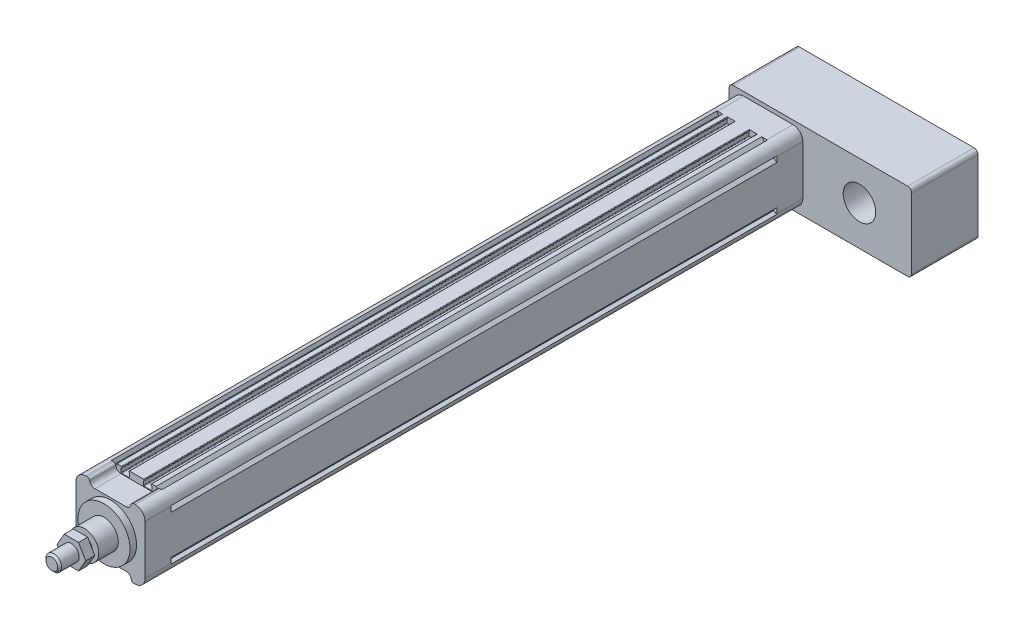
from build123d import *

# Parameters (mm, degrees)
SKETCH_1_R                  = 2.1
EXTRUDE_1_DEPTH             = 465
EXTRUDE_2_DEPTH             = 20
SKETCH_7_R                  = 20
EXTRUDE_3_DEPTH             = 5
SKETCH_9_R                  = 11
EXTRUDE_4_DEPTH             = 15
SKETCH_10_R                 = 6
EXTRUDE_5_DEPTH             = 25
EXTRUDE_START               = 20
EXTRUDE_6_DEPTH             = 20
EXTRUDE_7_DEPTH             = 51
SKETCH_13_R                 = 12.5
CUT_EXTRUDE_2_DEPTH         = 30
PATTERN_LINEAR_1_COUNT      = 2
PATTERN_LINEAR_1_PITCH      = 38
PATTERN_LINEAR_1_COUNT_DIR2 = 2
PATTERN_LINEAR_1_PITCH_DIR2 = 38
HOLE_WIZARD_M6_2_D          = 5
HOLE_WIZARD_M6_2_DEPTH      = 15
HOLE_WIZARD_M6_2_TIP        = 1.502151548
HOLE_WIZARD_M6_3_D          = 5
HOLE_WIZARD_M6_3_DEPTH      = 15
HOLE_WIZARD_M6_3_TIP        = 1.502151548
HOLE_WIZARD_M6_4_D          = 5
HOLE_WIZARD_M6_4_DEPTH      = 15
HOLE_WIZARD_M6_4_TIP        = 1.502151548
CHAMFER_1_SIZE              = 1.5
EXTRUDE_START_2             = 3
EXTRUDE_8_DEPTH             = 7


with BuildPart() as part:
    # 草图1 → 凸台-拉伸1 (new body)
    with BuildSketch(Plane.XY):
        with BuildLine():
            Line((-18.2, 24), (-19.443439638, 26.486879276))
            ThreePointArc((-19.443439638, 26.486879276), (-24.303300859, 24.303300859), (-26.486879276, 19.443439638))
            Line((-26.486879276, 19.443439638), (-24, 18.2))
            Line((-24, 18.2), (-24, 17.1))
            Line((-24, 17.1), (-26.5, 15))
            Line((-26.5, 15), (-26.5, -15))
            Line((-26.5, -15), (-24, -17.1))
            Line((-24, -17.1), (-24, -18.2))
            Line((-24, -18.2), (-26.486879276, -19.443439638))
            ThreePointArc((-26.486879276, -19.443439638), (-24.303300859, -24.303300859), (-19.443439638, -26.486879276))
            Line((-19.443439638, -26.486879276), (-18.2, -24))
            Line((-18.2, -24), (-17.1, -24))
            Line((-17.1, -24), (-15, -26.5))
            Line((-15, -26.5), (-11.65, -26.5))
            ThreePointArc((-11.65, -26.5), (-11.367157288, -26.382842712), (-11.25, -26.1))
            Line((-11.25, -26.1), (-11.25, -25.6))
            ThreePointArc((-11.25, -25.6), (-11.367157288, -25.317157288), (-11.65, -25.2))
            Line((-11.65, -25.2), (-11.75, -25.2))
            Line((-11.75, -25.2), (-11.75, -22.4))
            ThreePointArc((-11.75, -22.4), (-11.632842712, -22.117157288), (-11.35, -22))
            Line((-11.35, -22), (-5.65, -22))
            ThreePointArc((-5.65, -22), (-5.367157288, -22.117157288), (-5.25, -22.4))
            Line((-5.25, -22.4), (-5.25, -25.2))
            Line((-5.25, -25.2), (-5.35, -25.2))
            ThreePointArc((-5.35, -25.2), (-5.632842712, -25.317157288), (-5.75, -25.6))
            Line((-5.75, -25.6), (-5.75, -26.1))
            ThreePointArc((-5.75, -26.1), (-5.632842712, -26.382842712), (-5.35, -26.5))
            Line((-5.35, -26.5), (5.35, -26.5))
            ThreePointArc((5.35, -26.5), (5.632842712, -26.382842712), (5.75, -26.1))
            Line((5.75, -26.1), (5.75, -25.6))
            ThreePointArc((5.75, -25.6), (5.632842712, -25.317157288), (5.35, -25.2))
            Line((5.35, -25.2), (5.25, -25.2))
            Line((5.25, -25.2), (5.25, -22.4))
            ThreePointArc((5.25, -22.4), (5.367157288, -22.117157288), (5.65, -22))
            Line((5.65, -22), (11.35, -22))
            ThreePointArc((11.35, -22), (11.632842712, -22.117157288), (11.75, -22.4))
            Line((11.75, -22.4), (11.75, -25.2))
            Line((11.75, -25.2), (11.65, -25.2))
            ThreePointArc((11.65, -25.2), (11.367157288, -25.317157288), (11.25, -25.6))
            Line((11.25, -25.6), (11.25, -26.1))
            ThreePointArc((11.25, -26.1), (11.367157288, -26.382842712), (11.65, -26.5))
            Line((11.65, -26.5), (15, -26.5))
            Line((15, -26.5), (17.1, -24))
            Line((17.1, -24), (18.2, -24))
            Line((18.2, -24), (19.443439638, -26.486879276))
            ThreePointArc((19.443439638, -26.486879276), (24.303300859, -24.303300859), (26.486879276, -19.443439638))
            Line((26.486879276, -19.443439638), (24, -18.2))
            Line((24, -18.2), (24, -17.1))
            Line((24, -17.1), (26.5, -15))
            Line((26.5, -15), (26.5, 15))
            Line((26.5, 15), (24, 17.1))
            Line((24, 17.1), (24, 18.2))
            Line((24, 18.2), (26.486879276, 19.443439638))
            ThreePointArc((26.486879276, 19.443439638), (24.303300859, 24.303300859), (19.443439638, 26.486879276))
            Line((19.443439638, 26.486879276), (18.2, 24))
            Line((18.2, 24), (17.1, 24))
            Line((17.1, 24), (15, 26.5))
            Line((15, 26.5), (11.65, 26.5))
            ThreePointArc((11.65, 26.5), (11.367157288, 26.382842712), (11.25, 26.1))
            Line((11.25, 26.1), (11.25, 25.6))
            ThreePointArc((11.25, 25.6), (11.367157288, 25.317157288), (11.65, 25.2))
            Line((11.65, 25.2), (11.75, 25.2))
            Line((11.75, 25.2), (11.75, 22.4))
            ThreePointArc((11.75, 22.4), (11.632842712, 22.117157288), (11.35, 22))
            Line((11.35, 22), (5.65, 22))
            ThreePointArc((5.65, 22), (5.367157288, 22.117157288), (5.25, 22.4))
            Line((5.25, 22.4), (5.25, 25.2))
            Line((5.25, 25.2), (5.35, 25.2))
            ThreePointArc((5.35, 25.2), (5.632842712, 25.317157288), (5.75, 25.6))
            Line((5.75, 25.6), (5.75, 26.1))
            ThreePointArc((5.75, 26.1), (5.632842712, 26.382842712), (5.35, 26.5))
            Line((5.35, 26.5), (-5.35, 26.5))
            ThreePointArc((-5.35, 26.5), (-5.632842712, 26.382842712), (-5.75, 26.1))
            Line((-5.75, 26.1), (-5.75, 25.6))
            ThreePointArc((-5.75, 25.6), (-5.632842712, 25.317157288), (-5.35, 25.2))
            Line((-5.35, 25.2), (-5.25, 25.2))
            Line((-5.25, 25.2), (-5.25, 22.4))
            ThreePointArc((-5.25, 22.4), (-5.367157288, 22.117157288), (-5.65, 22))
            Line((-5.65, 22), (-11.35, 22))
            ThreePointArc((-11.35, 22), (-11.632842712, 22.117157288), (-11.75, 22.4))
            Line((-11.75, 22.4), (-11.75, 25.2))
            Line((-11.75, 25.2), (-11.65, 25.2))
            ThreePointArc((-11.65, 25.2), (-11.367157288, 25.317157288), (-11.25, 25.6))
            Line((-11.25, 25.6), (-11.25, 26.1))
            ThreePointArc((-11.25, 26.1), (-11.367157288, 26.382842712), (-11.65, 26.5))
            Line((-11.65, 26.5), (-15, 26.5))
            Line((-15, 26.5), (-17.1, 24))
            Line((-17.1, 24), (-18.2, 24))
        make_face()
        with Locations((19, 19)):
            Circle(SKETCH_1_R, mode=Mode.SUBTRACT)
        with Locations((19, -19)):
            Circle(SKETCH_1_R, mode=Mode.SUBTRACT)
        with Locations((-19, -19)):
            Circle(SKETCH_1_R, mode=Mode.SUBTRACT)
        with Locations((-19, 19)):
            Circle(SKETCH_1_R, mode=Mode.SUBTRACT)
        with BuildLine():
            Line((19.773719933, 3), (23.3, 3))
            Line((23.3, 3), (23.3, -3))
            Line((23.3, -3), (19.773719933, -3))
            ThreePointArc((19.773719933, -3), (0, -20), (-19.773719933, -3))
            Line((-19.773719933, -3), (-23.3, -3))
            Line((-23.3, -3), (-23.3, 3))
            Line((-23.3, 3), (-19.773719933, 3))
            ThreePointArc((-19.773719933, 3), (0, 20), (19.773719933, 3))
        make_face(mode=Mode.SUBTRACT)
    extrude(amount=EXTRUDE_1_DEPTH)

    # 草图6 → 凸台-拉伸2 (add)
    with BuildSketch(Plane.XY.offset(465)):
        with BuildLine():
            Line((-26.5, -19), (-26.5, 19))
            ThreePointArc((-26.5, 19), (-24.303300859, 24.303300859), (-19, 26.5))
            Line((-19, 26.5), (-17.916079783, 26.5))
            ThreePointArc((-17.916079783, 26.5), (-16.625085334, 26.027525232), (-15.944053189, 24.833333333))
            ThreePointArc((-15.944053189, 24.833333333), (-14.581988897, 22.444949537), (-12, 21.5))
            Line((-12, 21.5), (12, 21.5))
            ThreePointArc((12, 21.5), (14.581988897, 22.444949537), (15.944053189, 24.833333333))
            ThreePointArc((15.944053189, 24.833333333), (16.625085334, 26.027525232), (17.916079783, 26.5))
            Line((17.916079783, 26.5), (19, 26.5))
            ThreePointArc((19, 26.5), (24.303300859, 24.303300859), (26.5, 19))
            Line((26.5, 19), (26.5, -19))
            ThreePointArc((26.5, -19), (24.303300859, -24.303300859), (19, -26.5))
            Line((19, -26.5), (17.916079783, -26.5))
            ThreePointArc((17.916079783, -26.5), (16.625085334, -26.027525232), (15.944053189, -24.833333333))
            ThreePointArc((15.944053189, -24.833333333), (14.581988897, -22.444949537), (12, -21.5))
            Line((12, -21.5), (-12, -21.5))
            ThreePointArc((-12, -21.5), (-14.581988897, -22.444949537), (-15.944053189, -24.833333333))
            ThreePointArc((-15.944053189, -24.833333333), (-16.625085334, -26.027525232), (-17.916079783, -26.5))
            Line((-17.916079783, -26.5), (-19, -26.5))
            ThreePointArc((-19, -26.5), (-24.303300859, -24.303300859), (-26.5, -19))
        make_face()
    extrude(amount=EXTRUDE_2_DEPTH)

    # 草图7 → 凸台-拉伸3 (add)
    with BuildSketch(Plane.XY.offset(485)):
        Circle(SKETCH_7_R)
    extrude(amount=EXTRUDE_3_DEPTH)

    # 草图9 → 凸台-拉伸4 (add)
    with BuildSketch(Plane.XY.offset(490)):
        Circle(SKETCH_9_R)
    extrude(amount=EXTRUDE_4_DEPTH)

    # 草图10 → 凸台-拉伸5 (add)
    with BuildSketch(Plane.XY.offset(505)):
        Circle(SKETCH_10_R)
    extrude(amount=EXTRUDE_5_DEPTH)

    # 草图11 → 凸台-拉伸6 (add)
    with BuildSketch(Plane(origin=(0, 0, 0), x_dir=(-1, 0, 0), z_dir=(0, 0, -1)).offset(EXTRUDE_START)):
        with BuildLine():
            Line((-19, -26.5), (19, -26.5))
            ThreePointArc((19, -26.5), (24.303300859, -24.303300859), (26.5, -19))
            Line((26.5, -19), (26.5, 19))
            ThreePointArc((26.5, 19), (24.303300859, 24.303300859), (19, 26.5))
            Line((19, 26.5), (-19, 26.5))
            ThreePointArc((-19, 26.5), (-24.303300859, 24.303300859), (-26.5, 19))
            Line((-26.5, 19), (-26.5, -19))
            ThreePointArc((-26.5, -19), (-24.303300859, -24.303300859), (-19, -26.5))
        make_face()
    extrude(amount=-EXTRUDE_6_DEPTH)

    # 草图12 → 凸台-拉伸7 (add)
    with BuildSketch(Plane(origin=(0, 0, -20), x_dir=(-1, 0, 0), z_dir=(0, 0, -1))):
        with BuildLine():
            Line((-107, -30.404162038), (27, -30.404162038))
            ThreePointArc((27, -30.404162038), (29.121320344, -29.525482382), (30, -27.404162038))
            Line((30, -27.404162038), (30, 26.595837962))
            ThreePointArc((30, 26.595837962), (29.121320344, 28.717158305), (27, 29.595837962))
            Line((27, 29.595837962), (-107, 29.595837962))
            ThreePointArc((-107, 29.595837962), (-109.121320344, 28.717158305), (-110, 26.595837962))
            Line((-110, 26.595837962), (-110, -27.404162038))
            ThreePointArc((-110, -27.404162038), (-109.121320344, -29.525482382), (-107, -30.404162038))
        make_face()
    extrude(amount=EXTRUDE_7_DEPTH)

    # 草图13 → 切除-拉伸2 (cut)
    with BuildSketch(Plane.XY.offset(-20)):
        with Locations((70, 0)):
            Circle(SKETCH_13_R)
    extrude(amount=-CUT_EXTRUDE_2_DEPTH, mode=Mode.SUBTRACT)

    # 草图15 → M6 螺纹孔1 (revolve, cut)
    with BuildSketch(Plane(origin=(-19, -19, -71), x_dir=(0, 1, 0), z_dir=(1, 0, 0))):
        Polygon((0, 0), (0, 16.502151548), (2.5, 15), (2.5, 0), align=None)
    hole_wizard_m6_1 = revolve(axis=Axis((-19, -19, -77.35), (0, 0, 1)), mode=Mode.SUBTRACT)

    # 阵列(线性)1: Hole Wizard M6 _1 2 × 2
    with Locations(*[(j * PATTERN_LINEAR_1_PITCH_DIR2, i * PATTERN_LINEAR_1_PITCH, 0) for i in range(PATTERN_LINEAR_1_COUNT) for j in range(PATTERN_LINEAR_1_COUNT_DIR2) if (i, j) != (0, 0)]):
        add(hole_wizard_m6_1, mode=Mode.SUBTRACT)

    # M6 螺纹孔2
    with Locations(Plane(origin=(0, 0, -71), x_dir=(-1, 0, 0), z_dir=(0, 0, -1))):
        with Locations((-84, -19), (-84, 19)):
            Hole(HOLE_WIZARD_M6_2_D / 2, depth=HOLE_WIZARD_M6_2_DEPTH)
            with Locations((0, 0, -(HOLE_WIZARD_M6_2_DEPTH + HOLE_WIZARD_M6_2_TIP / 2))):  # 118° drill point
                Cone(0, HOLE_WIZARD_M6_2_D / 2, HOLE_WIZARD_M6_2_TIP, mode=Mode.SUBTRACT)

    # M6 螺纹孔3
    with Locations(Plane.ZY.offset(26.5)):
        with Locations((475, 11), (475, -11)):
            Hole(HOLE_WIZARD_M6_3_D / 2, depth=HOLE_WIZARD_M6_3_DEPTH)
            with Locations((0, 0, -(HOLE_WIZARD_M6_3_DEPTH + HOLE_WIZARD_M6_3_TIP / 2))):  # 118° drill point
                Cone(0, HOLE_WIZARD_M6_3_D / 2, HOLE_WIZARD_M6_3_TIP, mode=Mode.SUBTRACT)

    # M6 螺纹孔4
    with Locations(Plane.ZY.offset(26.5)):
        with Locations((-10, 11), (-10, -11)):
            Hole(HOLE_WIZARD_M6_4_D / 2, depth=HOLE_WIZARD_M6_4_DEPTH)
            with Locations((0, 0, -(HOLE_WIZARD_M6_4_DEPTH + HOLE_WIZARD_M6_4_TIP / 2))):  # 118° drill point
                Cone(0, HOLE_WIZARD_M6_4_D / 2, HOLE_WIZARD_M6_4_TIP, mode=Mode.SUBTRACT)

    # 倒角1
    chamfer_1_edges = [part.edges().sort_by_distance(p)[0] for p in [
        (-6, 0, 530),
    ]]
    chamfer(chamfer_1_edges, length=CHAMFER_1_SIZE)

    # 草图23 → 凸台-拉伸8 (add)
    with BuildSketch(Plane.XY.offset(505).offset(EXTRUDE_START_2)):
        Polygon((10.969655115, 0), (5.484827557, 9.5), (-5.484827557, 9.5), (-10.969655115, 0), (-5.484827557, -9.5), (5.484827557, -9.5), align=None)
    extrude(amount=EXTRUDE_8_DEPTH)


solid = part.part
